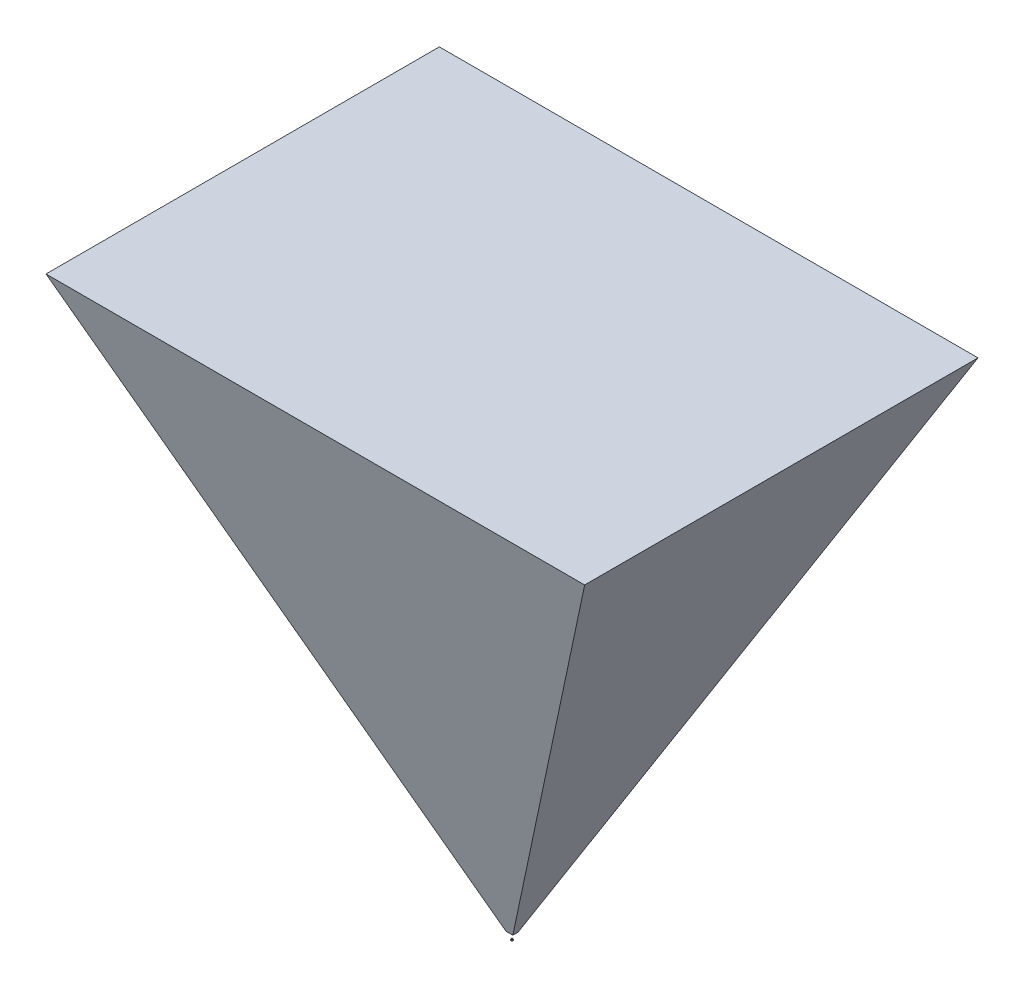
from build123d import *

# Parameters (mm, degrees)
SKIZZE4_W             = 0.25
SKIZZE4_H             = 1
TOOLFACE_ANGLE        = 60
KREISMUSTER1_COUNT    = 3
FOV_3_6MM_F_2_9_DEPTH = 1500
FOV2_DEPTH            = 2229.624130148
FOV2_DEPTH_BACK       = 2229.624130148
SKIZZE8_OUTSIDE_W     = 3714.166
SKIZZE8_OUTSIDE_H     = 2265.424
SKIZZE8_OUTSIDE_R     = 5


with BuildPart() as part:
    # Skizze3 → Body (revolve)
    with BuildSketch(Plane.XY, mode=Mode.PRIVATE) as body_sk:
        with BuildLine():
            Line((1, 0.8), (2.75, 0.8))
            Line((2.75, 0.8), (2.75, -2.55))
            Line((2.75, -2.55), (2.1, -2.55))
            Line((2.1, -2.55), (1.8, -2.25))
            ThreePointArc((1.8, -2.25), (0.91241438, -2.474486277), (0, -2.55))
            Line((0, -2.55), (0, 0.525))
            ThreePointArc((0, 0.525), (0.316474723, 0.499842016), (0.625, 0.425))
            Line((0.625, 0.425), (1, 0.8))
        make_face()
    revolve(body_sk.sketch.rotate(Axis((0, 0, 0), (0, -1, 0)), 90), axis=Axis((0, 0, 0), (0, -1, 0)))

    # Skizze4 → Thread (revolve)
    with BuildSketch(Plane.XY):
        with Locations((2.875, -0.7)):
            Rectangle(SKIZZE4_W, SKIZZE4_H)
    revolve(axis=Axis((0, 0, 0), (0, 1, 0)))

    # Skizze5 → Toolface (revolve, cut)
    with BuildSketch(Plane(origin=(0, 0, 0), x_dir=(0, 0, -1), z_dir=(1, 0, 0))):
        Polygon((2.75, 0.8), (2.75, 0.35), (2.3, 0.8), align=None)
    toolface = revolve(axis=Axis((0, 0, 0), (0, -1, 0)), revolution_arc=TOOLFACE_ANGLE, mode=Mode.SUBTRACT)

    # Kreismuster1: Toolface ×3 about axis
    kreismuster1_axis = Axis((0, 0, 0), (0, 1, 0))
    for i in range(1, KREISMUSTER1_COUNT):
        add(toolface.rotate(kreismuster1_axis, i * 360 / KREISMUSTER1_COUNT), mode=Mode.SUBTRACT)


with BuildPart() as body_2:
    # Skizze6 → FOV - 3,6mm f/2,9 (new, symmetric)
    with BuildSketch(Plane(origin=(0, 0, 0), x_dir=(0, 0, -1), z_dir=(1, 0, 0))):
        Polygon((-7.279404685, 18.707826613), (-564.153863113, 1548.707826613), (564.153863113, 1548.707826613), (7.279404685, 18.707826613), align=None)
    extrude(amount=FOV_3_6MM_F_2_9_DEPTH, both=True)

    # Skizze8 outside → FOV2 (cut, two sides: drawn at the far end of the back side and taken through both)
    with BuildSketch(Plane.XY.offset(-FOV2_DEPTH_BACK)):
        with Locations((0, 773.079)):
            Rectangle(SKIZZE8_OUTSIDE_W, SKIZZE8_OUTSIDE_H)
        Circle(SKIZZE8_OUTSIDE_R, mode=Mode.SUBTRACT)
        Polygon((-9.740481092, 18.707826613), (-772.570341414, 1548.707826613), (772.570341414, 1548.707826613), (9.740481092, 18.707826613), align=None, mode=Mode.SUBTRACT)
    extrude(amount=FOV2_DEPTH + FOV2_DEPTH_BACK, mode=Mode.SUBTRACT)


solid = Compound([part.part, body_2.part])
